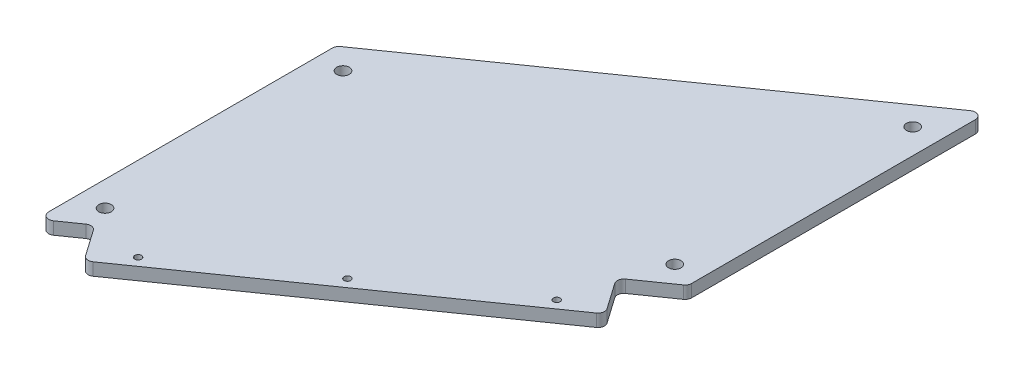
from build123d import *

# Parameters (mm, degrees)
BOSS_EXTRUDE1_DEPTH = 12.7
CUT_EXTRUDE1_DEPTH  = 742.687355867
SKETCH3_R           = 3.3782
SKETCH3_R_2         = 6.35
CUT_EXTRUDE2_DEPTH  = 742.687355867
FILLET1_R           = 6.604


with BuildPart() as part:
    # Sketch1 → Boss-Extrude1 (new body)
    with BuildSketch(Plane(origin=(0, 0, 0), x_dir=(1, 0, 0), z_dir=(0, 1, 0))):
        Polygon((0, 0), (0, 359.06343047), (388.9375, 631.400399863), (388.9375, 272.336969392), align=None)
    extrude(amount=BOSS_EXTRUDE1_DEPTH)

    # Sketch2 → Cut-Extrude1 (cut, through all)
    with BuildSketch(Plane(origin=(0, 12.7, 0), x_dir=(1, 0, 0), z_dir=(0, 1, 0))):
        Polygon((35.056131737, 79.74022841), (60.988669577, 42.704726183), (0, 0), (0, 55.193660707), align=None)
        Polygon((388.9375, 327.5306301), (346.099711846, 297.535287914), (372.032249686, 260.499785687), (388.9375, 272.336969392), align=None)
    extrude(amount=-CUT_EXTRUDE1_DEPTH, mode=Mode.SUBTRACT)

    # Sketch3 → Cut-Extrude2 (cut, through all)
    with BuildSketch(Plane(origin=(0, 12.7, 0), x_dir=(1, 0, 0), z_dir=(0, 1, 0))):
        with Locations(Location((210.136591483, 160.705083027, 0), (0, 0, 270))):
            Circle(SKETCH3_R)
        with Locations(Location((334.975363032, 248.118131927, 0), (0, 0, 270))):
            Circle(SKETCH3_R)
        with Locations(Location((85.297819933, 73.292034127, 0), (0, 0, 270))):
            Circle(SKETCH3_R)
        with Locations(Location((25.4, 99.643660707, 0), (0, 0, 270))):
            Circle(SKETCH3_R_2)
        with Locations(Location((25.4, 340.943660707, 0), (0, 0, 270))):
            Circle(SKETCH3_R_2)
        with Locations(Location((363.5375, 339.300399863, 0), (0, 0, 270))):
            Circle(SKETCH3_R_2)
        with Locations(Location((363.5375, 580.600399863, 0), (0, 0, 270))):
            Circle(SKETCH3_R_2)
    extrude(amount=-CUT_EXTRUDE2_DEPTH, mode=Mode.SUBTRACT)

    # Fillet1
    fillet1_edges = [part.edges().sort_by_distance(p)[0] for p in [
        (0, 6.35, -55.193660707),
        (35.056131737, 6.35, -79.74022841),
        (60.988669577, 6.35, -42.704726183),
        (388.9375, 6.35, -327.5306301),
        (372.032249686, 6.35, -260.499785687),
        (346.099711846, 6.35, -297.535287914),
        (0, 6.35, -359.06343047),
        (388.9375, 6.35, -631.400399863),
    ]]
    fillet(fillet1_edges, radius=FILLET1_R)


solid = part.part
